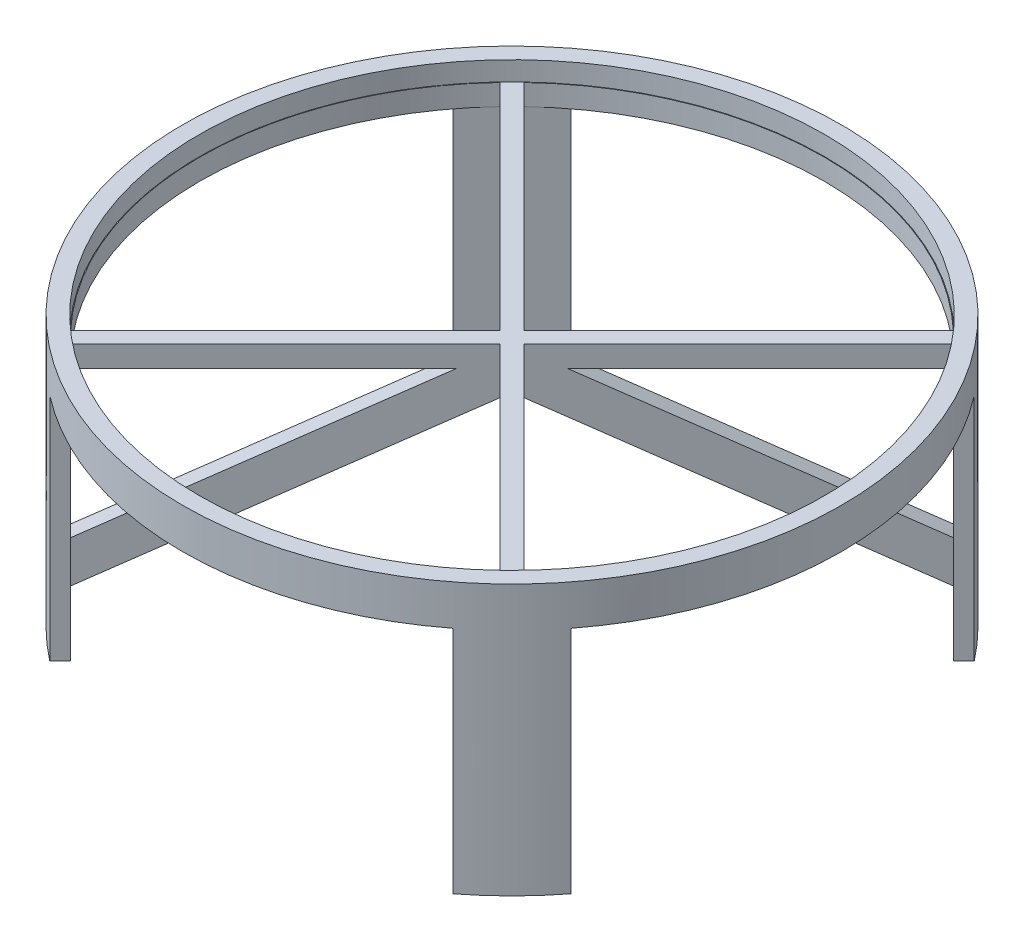
from build123d import *
from build123d.topology import SkipClean

# Parameters (mm, degrees)
SKETCH1_R                = 100
BOSS_EXTRUDE1_DEPTH      = 6.35
BOSS_EXTRUDE2_DEPTH      = 14.986
BOSS_EXTRUDE2_DEPTH_BACK = 76.128786138
SKETCH3_R                = 100
SKETCH3_R_2              = 94.92
BOSS_EXTRUDE3_DEPTH      = 5.842
CIRPATTERN1_COUNT        = 4
SKETCH29_W               = 5.08
SKETCH29_H               = 12.7
BOSS_EXTRUDE4_DEPTH      = 6.35
CIRPATTERN2_COUNT        = 4
CUT_EXTRUDE3_DEPTH       = 6.35
CUT_EXTRUDE4_START       = -9.144
CUT_EXTRUDE4_DEPTH       = 9.144
CIRPATTERN3_COUNT        = 4
BOSS_EXTRUDE6_DEPTH      = 12.7
CIRPATTERN4_COUNT        = 4
SKETCH34_W               = 25.4
SKETCH34_H               = 132.842
CUT_EXTRUDE5_DEPTH       = 7.62
CIRPATTERN5_COUNT        = 4
CUT_EXTRUDE6_START       = -88.9
CUT_EXTRUDE6_DEPTH       = 88.9


with BuildPart() as part:
    # Sketch1 → Boss-Extrude1 (new body)
    with BuildSketch(Plane(origin=(0, 0, 0), x_dir=(1, 0, 0), z_dir=(0, 1, 0))):
        with Locations(Location((0, 0, 0), (0, 0, 270))):
            Circle(SKETCH1_R)
    extrude(amount=BOSS_EXTRUDE1_DEPTH)

    # Sketch2 → Boss-Extrude2 (add, two sides: drawn at the far end of the back side and taken through both)
    with BuildSketch(Plane(origin=(0, 6.35, 0), x_dir=(1, 0, 0), z_dir=(0, 1, 0)).offset(-BOSS_EXTRUDE2_DEPTH_BACK)):
        with BuildLine():
            Line((70.138113747, -88.098625989), (79.118369868, -79.118369868))
            Line((79.118369868, -79.118369868), (88.098625989, -70.138113747))
            Line((88.098625989, -70.138113747), (79.118369868, -61.157857626))
            ThreePointArc((79.118369868, -61.157857626), (70.710678119, -70.710678119), (61.157857626, -79.118369868))
            Line((61.157857626, -79.118369868), (70.138113747, -88.098625989))
        make_face()
        with BuildLine():
            ThreePointArc((61.157857626, 79.118369868), (70.710678119, 70.710678119), (79.118369868, 61.157857626))
            Line((79.118369868, 61.157857626), (88.098625989, 70.138113747))
            Line((88.098625989, 70.138113747), (79.118369868, 79.118369868))
            Line((79.118369868, 79.118369868), (70.138113747, 88.098625989))
            Line((70.138113747, 88.098625989), (61.157857626, 79.118369868))
        make_face()
        with BuildLine():
            Line((-88.098625989, 70.138113747), (-79.118369868, 61.157857626))
            ThreePointArc((-79.118369868, 61.157857626), (-70.710678119, 70.710678119), (-61.157857626, 79.118369868))
            Line((-61.157857626, 79.118369868), (-70.138113747, 88.098625989))
            Line((-70.138113747, 88.098625989), (-79.118369868, 79.118369868))
            Line((-79.118369868, 79.118369868), (-88.098625989, 70.138113747))
        make_face()
        with BuildLine():
            Line((-79.118369868, -61.157857626), (-88.098625989, -70.138113747))
            Line((-88.098625989, -70.138113747), (-79.118369868, -79.118369868))
            Line((-79.118369868, -79.118369868), (-70.138113747, -88.098625989))
            Line((-70.138113747, -88.098625989), (-61.157857626, -79.118369868))
            ThreePointArc((-61.157857626, -79.118369868), (-70.710678119, -70.710678119), (-79.118369868, -61.157857626))
        make_face()
    extrude(amount=BOSS_EXTRUDE2_DEPTH + BOSS_EXTRUDE2_DEPTH_BACK)

    # Sketch3 → Boss-Extrude3 (add)
    with BuildSketch(Plane(origin=(0, 6.35, 0), x_dir=(1, 0, 0), z_dir=(0, 1, 0))):
        Circle(SKETCH3_R)
        with Locations(Location((0, 0, 0), (0, 0, 270))):
            Circle(SKETCH3_R_2, mode=Mode.SUBTRACT)
    extrude(amount=BOSS_EXTRUDE3_DEPTH)

    # Sweep1: sweep along a curve in space
    with BuildLine() as sweep1_path:
        Line((0, 0, 0), (-70.138113747, -53.268786138, -70.138113747))
    # 3DSketch4 → Sweep1 (sweep)
    with BuildSketch(Plane(origin=(-68.342062523, -59.618786138, -71.934164971), x_dir=(-0.262612865719444, 0.9284766908852601, 0.262612865719444), z_dir=(0.7071067811865448, -1.540105097113694e-15, 0.7071067811865502))):
        Polygon((0, 0), (1.886664636, 4.71666159), (13.67831861, 0), (11.791653974, -4.71666159), align=None)
    sweep1 = sweep(path=sweep1_path.line)

    # CirPattern1: Sweep1 ×4 about axis
    cirpattern1_axis = Axis((0, 0, 0), (0, 1, 0))
    for i in range(1, CIRPATTERN1_COUNT):
        add(sweep1.rotate(cirpattern1_axis, i * 360 / CIRPATTERN1_COUNT))

    # Sketch29 → Boss-Extrude4 (add)
    with BuildSketch(Plane(origin=(70.138113747, 0, 70.138113747), x_dir=(0.7071067811865501, 0, -0.7071067811865449), z_dir=(0.7071067811865449, 0, 0.7071067811865501))):
        with Locations((0, -53.268786138)):
            Rectangle(SKETCH29_W, SKETCH29_H)
    boss_extrude4 = extrude(amount=BOSS_EXTRUDE4_DEPTH)

    # CirPattern2: Boss-Extrude4 ×4 about axis
    cirpattern2_axis = Axis((0, 0, 0), (0, 1, 0))
    for i in range(1, CIRPATTERN2_COUNT):
        add(boss_extrude4.rotate(cirpattern2_axis, i * 360 / CIRPATTERN2_COUNT))

    # Sketch30 → Cut-Extrude3 (cut)
    with BuildSketch(Plane(origin=(0, 6.35, 0), x_dir=(1, 0, 0), z_dir=(0, 1, 0))):
        with BuildLine():
            Line((-10.1569893, -6.564886852), (-68.764267193, -65.172164744))
            ThreePointArc((-68.764267193, -65.172164744), (-94.741413859, 0), (-68.764267193, 65.172164744))
            Line((-68.764267193, 65.172164744), (-10.1569893, 6.564886852))
            Line((-10.1569893, 6.564886852), (-3.592102448, 0))
            Line((-3.592102448, 0), (-10.1569893, -6.564886852))
        make_face()
        with BuildLine():
            Line((-6.564886852, -10.1569893), (-65.172164744, -68.764267193))
            ThreePointArc((-65.172164744, -68.764267193), (0, -94.741413859), (65.172164744, -68.764267193))
            Line((65.172164744, -68.764267193), (6.564886852, -10.1569893))
            Line((6.564886852, -10.1569893), (0, -3.592102448))
            Line((0, -3.592102448), (-6.564886852, -10.1569893))
        make_face()
        with BuildLine():
            Line((-6.564886852, 10.1569893), (-65.172164744, 68.764267193))
            ThreePointArc((-65.172164744, 68.764267193), (0, 94.741413859), (65.172164744, 68.764267193))
            Line((65.172164744, 68.764267193), (6.564886852, 10.1569893))
            Line((6.564886852, 10.1569893), (0, 3.592102448))
            Line((0, 3.592102448), (-6.564886852, 10.1569893))
        make_face()
        with BuildLine():
            Line((10.1569893, 6.564886852), (68.764267193, 65.172164744))
            ThreePointArc((68.764267193, 65.172164744), (94.741413859, 0), (68.764267193, -65.172164744))
            Line((68.764267193, -65.172164744), (10.1569893, -6.564886852))
            Line((10.1569893, -6.564886852), (3.592102448, 0))
            Line((3.592102448, 0), (10.1569893, 6.564886852))
        make_face()
    extrude(amount=-CUT_EXTRUDE3_DEPTH, mode=Mode.SUBTRACT)

    # Sketch32 → Cut-Extrude4 (cut)
    with BuildSketch(Plane(origin=(0, 21.336, 0), x_dir=(1, 0, 0), z_dir=(0, 1, 0)).offset(CUT_EXTRUDE4_START)):
        with BuildLine():
            Line((79.118369868, 61.157857626), (88.098625989, 70.138113747))
            Line((88.098625989, 70.138113747), (70.138113747, 88.098625989))
            Line((70.138113747, 88.098625989), (61.157857626, 79.118369868))
            ThreePointArc((61.157857626, 79.118369868), (70.710678119, 70.710678119), (79.118369868, 61.157857626))
        make_face()
    cut_extrude4 = extrude(amount=CUT_EXTRUDE4_DEPTH, mode=Mode.SUBTRACT)

    # CirPattern3: Cut-Extrude4 ×4 about axis
    cirpattern3_axis = Axis((0, 12.192, 0), (0, -1, 0))
    for i in range(1, CIRPATTERN3_COUNT):
        add(cut_extrude4.rotate(cirpattern3_axis, i * 360 / CIRPATTERN3_COUNT), mode=Mode.SUBTRACT)

    # Sketch33 → Boss-Extrude6 (add, symmetric)
    with BuildSketch(Plane(origin=(0, 0, 0), x_dir=(-0.7071067811865438, 0, -0.7071067811865513), z_dir=(0.7071067811865513, 0, -0.7071067811865438))):
        Polygon((-94.707359271, -49.941543909), (-94.707359271, 0), (-100, 0), (-100, -46.918786138), (-100, -69.778786138), (-99.1902717, -69.778786138), (-94.707359271, -69.778786138), (-94.707359271, -63.948606699), align=None)
    boss_extrude6 = extrude(amount=BOSS_EXTRUDE6_DEPTH, both=True)

    # CirPattern4: Boss-Extrude6 ×4 about axis
    cirpattern4_axis = Axis((0, 0, 0), (0, 1, 0))
    for i in range(1, CIRPATTERN4_COUNT):
        add(boss_extrude6.rotate(cirpattern4_axis, i * 360 / CIRPATTERN4_COUNT))

    # Sketch34 → Cut-Extrude5 (cut)
    with BuildSketch(Plane(origin=(79.118369868, 0, 79.118369868), x_dir=(0.7071067811865465, 0, -0.7071067811865486), z_dir=(0.7071067811865486, 0, 0.7071067811865465))):
        with Locations((0, -54.229)):
            Rectangle(SKETCH34_W, SKETCH34_H)
    cut_extrude5 = extrude(amount=-CUT_EXTRUDE5_DEPTH, mode=Mode.SUBTRACT)

    # CirPattern5: Cut-Extrude5 ×4 about axis
    cirpattern5_axis = Axis((0, 0, 0), (0, 1, 0))
    for i in range(1, CIRPATTERN5_COUNT):
        add(cut_extrude5.rotate(cirpattern5_axis, i * 360 / CIRPATTERN5_COUNT), mode=Mode.SUBTRACT)

    # Sketch35 → Cut-Extrude6 (cut)
    with SkipClean():  # the faces are left unmerged after this step: merging them gives an invalid solid
        with BuildSketch(Plane(origin=(0, 12.192, 0), x_dir=(1, 0, 0), z_dir=(0, 1, 0)).offset(CUT_EXTRUDE6_START)):
            with BuildLine():
                Line((-61.157857626, 79.118369868), (-64.749960074, 82.710472317))
                Line((-64.749960074, 82.710472317), (-82.710472317, 64.749960074))
                Line((-82.710472317, 64.749960074), (-79.118369868, 61.157857626))
                ThreePointArc((-79.118369868, 61.157857626), (-70.710678119, 70.710678119), (-61.157857626, 79.118369868))
            make_face()
            with BuildLine():
                Line((-64.749960074, -82.710472317), (-61.157857626, -79.118369868))
                ThreePointArc((-61.157857626, -79.118369868), (-70.710678119, -70.710678119), (-79.118369868, -61.157857626))
                Line((-79.118369868, -61.157857626), (-82.710472317, -64.749960074))
                Line((-82.710472317, -64.749960074), (-64.749960074, -82.710472317))
            make_face()
            with BuildLine():
                Line((61.157857626, -79.118369868), (64.749960074, -82.710472317))
                Line((64.749960074, -82.710472317), (82.710472317, -64.749960074))
                Line((82.710472317, -64.749960074), (79.118369868, -61.157857626))
                ThreePointArc((79.118369868, -61.157857626), (70.710678119, -70.710678119), (61.157857626, -79.118369868))
            make_face()
            with BuildLine():
                Line((79.118369868, 61.157857626), (82.710472317, 64.749960074))
                Line((82.710472317, 64.749960074), (64.749960074, 82.710472317))
                Line((64.749960074, 82.710472317), (61.157857626, 79.118369868))
                ThreePointArc((61.157857626, 79.118369868), (70.710678119, 70.710678119), (79.118369868, 61.157857626))
            make_face()
        extrude(amount=CUT_EXTRUDE6_DEPTH, mode=Mode.SUBTRACT)


solid = part.part
